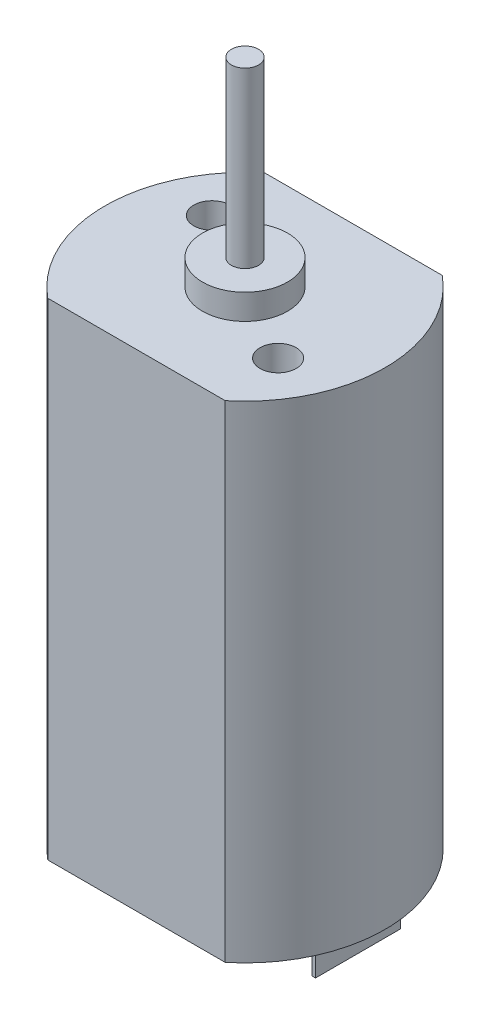
from build123d import *

# Parameters (mm, degrees)
BOSS_EXTRUDE1_DEPTH = 13.45
SKETCH2_R           = 2.35
BOSS_EXTRUDE2_DEPTH = 1.4
SKETCH3_R           = 0.75
BOSS_EXTRUDE5_DEPTH = 9.6
SKETCH4_W           = 0.2
SKETCH4_H           = 4.7
BOSS_EXTRUDE6_DEPTH = 1.9
SKETCH5_R           = 1
CUT_EXTRUDE1_DEPTH  = 1.9


with BuildPart() as part:
    # Sketch1 → Boss-Extrude1 (new, symmetric)
    with BuildSketch(Plane(origin=(0, 0, 0), x_dir=(1, 0, 0), z_dir=(0, 1, 0))):
        with BuildLine():
            Line((-4.905354218, 6), (4.905354218, 6))
            ThreePointArc((4.905354218, 6), (7.75, 0), (4.905354218, -6))
            Line((4.905354218, -6), (-4.905354218, -6))
            ThreePointArc((-4.905354218, -6), (-7.75, 0), (-4.905354218, 6))
        make_face()
    extrude(amount=BOSS_EXTRUDE1_DEPTH, both=True)

    # Sketch2 → Boss-Extrude2 (add)
    with BuildSketch(Plane(origin=(0, 13.45, 0), x_dir=(1, 0, 0), z_dir=(0, 1, 0))):
        with Locations(Location((0, 0, 0), (0, 0, 270))):
            Circle(SKETCH2_R)
    extrude(amount=BOSS_EXTRUDE2_DEPTH)

    # Sketch3 → Boss-Extrude5 (add)
    with BuildSketch(Plane(origin=(0, 14.85, 0), x_dir=(1, 0, 0), z_dir=(0, 1, 0))):
        with Locations(Location((0, 0, 0), (0, 0, 270))):
            Circle(SKETCH3_R)
    extrude(amount=BOSS_EXTRUDE5_DEPTH)

    # Sketch4 → Boss-Extrude6 (add)
    with BuildSketch(Plane.XZ.offset(13.45)):
        with Locations((-6.15, 0)):
            Rectangle(SKETCH4_W, SKETCH4_H)
        with Locations((6.15, 0)):
            Rectangle(SKETCH4_W, SKETCH4_H)
    extrude(amount=BOSS_EXTRUDE6_DEPTH)

    # Sketch5 → Cut-Extrude1 (cut)
    with BuildSketch(Plane(origin=(0, 13.45, 0), x_dir=(1, 0, 0), z_dir=(0, 1, 0))):
        with Locations(Location((-4.330127019, 2.5, 0), (0, 0, 270))):
            Circle(SKETCH5_R)
        with Locations(Location((4.330127019, -2.5, 0), (0, 0, 270))):
            Circle(SKETCH5_R)
    extrude(amount=-CUT_EXTRUDE1_DEPTH, mode=Mode.SUBTRACT)


solid = part.part
